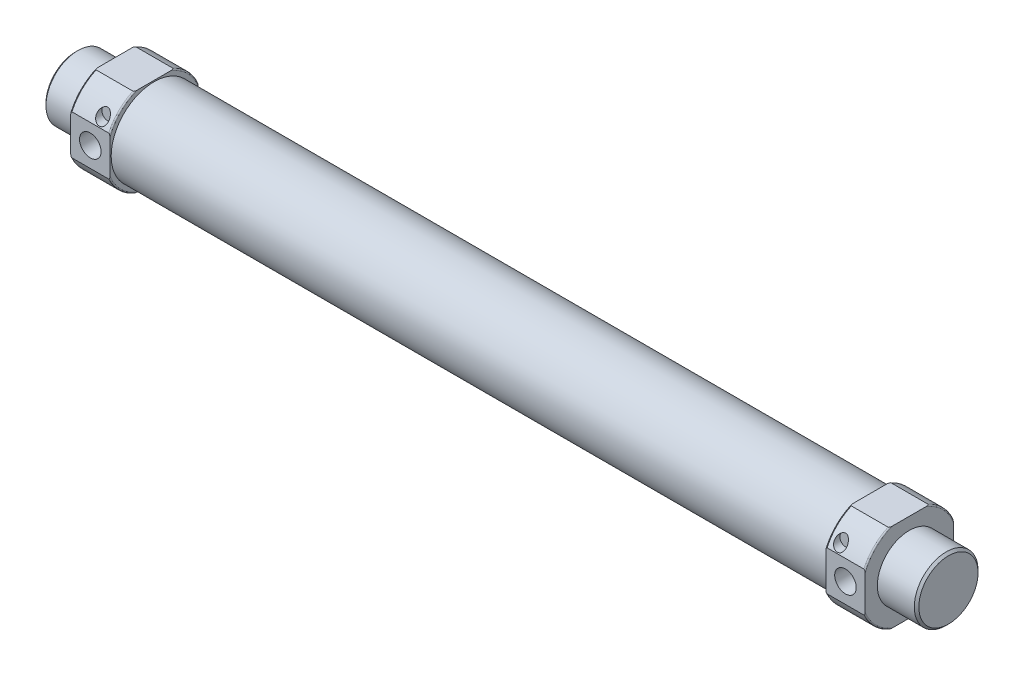
from build123d import *

# Parameters (mm, degrees)
SKETCH_3_W                = 79
SKETCH_3_H                = 79
SKETCH_3_W_2              = 36
SKETCH_3_H_2              = 36
CUT_EXTRUDE_1_DEPTH       = 324
SKETCH_8_W                = 3.7
SKETCH_8_H                = 2.5
SKETCH_9_W                = 3.7
SKETCH_9_H                = 2.5
HOLE_WIZARD_G1_8_1_REACH  = 328.49
HOLE_WIZARD_G1_8_1_BORE_R = 4.4


with BuildPart() as part:
    # 草图1 → 旋转1 (revolve)
    with BuildSketch(Plane.XY, mode=Mode.PRIVATE) as revolve_1_sk:
        with BuildLine():
            Line((-32, 0), (-32, 12.08))
            Line((-32, 12.08), (-31.08, 13))
            Line((-31.08, 13), (-16, 13))
            Line((-16, 13), (-16, 19.25))
            ThreePointArc((-16, 19.25), (-15.853553391, 19.603553391), (-15.5, 19.75))
            Line((-15.5, 19.75), (-0.5, 19.75))
            ThreePointArc((-0.5, 19.75), (-0.146446609, 19.603553391), (0, 19.25))
            Line((0, 19.25), (0, 17.5))
            Line((0, 17.5), (292, 17.5))
            Line((292, 17.5), (292, 16.707106781))
            Line((292, 16.707106781), (291.292893219, 16))
            Line((291.292893219, 16), (10, 16))
            Line((10, 16), (10, 8.5))
            Line((10, 8.5), (-18, 8.5))
            Line((-18, 8.5), (-22.907477288, 0))
            Line((-22.907477288, 0), (-32, 0))
        make_face()
    revolve(revolve_1_sk.sketch.rotate(Axis((10, 0, 0), (-1, 0, 0)), 270), axis=Axis((10, 0, 0), (-1, 0, 0)))

    # 草图2 → 旋转2 (revolve)
    with BuildSketch(Plane.XY, mode=Mode.PRIVATE) as revolve_2_sk:
        with BuildLine():
            Line((314.907477288, 0), (310, 8.5))
            Line((310, 8.5), (282, 8.5))
            Line((282, 8.5), (282, 16))
            Line((282, 16), (292, 16))
            Line((292, 16), (292, 19.25))
            ThreePointArc((292, 19.25), (292.146446609, 19.603553391), (292.5, 19.75))
            Line((292.5, 19.75), (307.5, 19.75))
            ThreePointArc((307.5, 19.75), (307.853553391, 19.603553391), (308, 19.25))
            Line((308, 19.25), (308, 13))
            Line((308, 13), (323.08, 13))
            Line((323.08, 13), (324, 12.08))
            Line((324, 12.08), (324, 0))
            Line((324, 0), (314.907477288, 0))
        make_face()
    revolve(revolve_2_sk.sketch.rotate(Axis((324, 0, 0), (-1, 0, 0)), 270), axis=Axis((324, 0, 0), (-1, 0, 0)))

    # 草图3 → 切除-拉伸1 (cut)
    with BuildSketch(Plane(origin=(-16, 0, 0), x_dir=(0, 0, -1), z_dir=(1, 0, 0))):
        Rectangle(SKETCH_3_W, SKETCH_3_H)
        Rectangle(SKETCH_3_W_2, SKETCH_3_H_2, mode=Mode.SUBTRACT)
    extrude(amount=CUT_EXTRUDE_1_DEPTH, mode=Mode.SUBTRACT)

    # 草图8 → 切除-旋转1 (revolve, cut)
    with BuildSketch(Plane(origin=(-4.5, 0, 0), x_dir=(0, 0, -1), z_dir=(1, 0, 0)), mode=Mode.PRIVATE) as cut_revolve_1_sk:
        with Locations((-16.15, 12.25)):
            Rectangle(SKETCH_8_W, SKETCH_8_H)
    revolve(cut_revolve_1_sk.sketch.rotate(Axis((-4.5, 11, 14.3), (0, 0, 1)), 270), axis=Axis((-4.5, 11, 14.3), (0, 0, 1)), mode=Mode.SUBTRACT)

    # 草图9 → 切除-旋转2 (revolve, cut)
    with BuildSketch(Plane(origin=(296.5, 0, 0), x_dir=(0, 0, -1), z_dir=(1, 0, 0)), mode=Mode.PRIVATE) as cut_revolve_2_sk:
        with Locations((-16.15, 12.25)):
            Rectangle(SKETCH_9_W, SKETCH_9_H)
    revolve(cut_revolve_2_sk.sketch.rotate(Axis((296.5, 11, 14.3), (0, 0, 1)), 270), axis=Axis((296.5, 11, 14.3), (0, 0, 1)), mode=Mode.SUBTRACT)

    # G1/8 螺纹孔1 bore → G1/8 螺纹孔1 (cut, up to next)
    with BuildSketch(Plane.XY.offset(18), mode=Mode.PRIVATE) as hole_wizard_g1_8_1_sk1:
        with Locations((-8, 0)):
            Circle(HOLE_WIZARD_G1_8_1_BORE_R)
    hole_wizard_g1_8_1_tool1 = extrude(hole_wizard_g1_8_1_sk1.sketch, amount=-HOLE_WIZARD_G1_8_1_REACH, mode=Mode.PRIVATE) & part.part
    # G1/8 螺纹孔1 bore → G1/8 螺纹孔1 (cut, up to next)
    with BuildSketch(Plane.XY.offset(18), mode=Mode.PRIVATE) as hole_wizard_g1_8_1_sk2:
        with Locations((300, 0)):
            Circle(HOLE_WIZARD_G1_8_1_BORE_R)
    hole_wizard_g1_8_1_tool2 = extrude(hole_wizard_g1_8_1_sk2.sketch, amount=-HOLE_WIZARD_G1_8_1_REACH, mode=Mode.PRIVATE) & part.part
    add(hole_wizard_g1_8_1_tool1.solids().sort_by_distance((-8, 0, 18))[0], mode=Mode.SUBTRACT)
    add(hole_wizard_g1_8_1_tool2.solids().sort_by_distance((300, 0, 18))[0], mode=Mode.SUBTRACT)


solid = part.part
